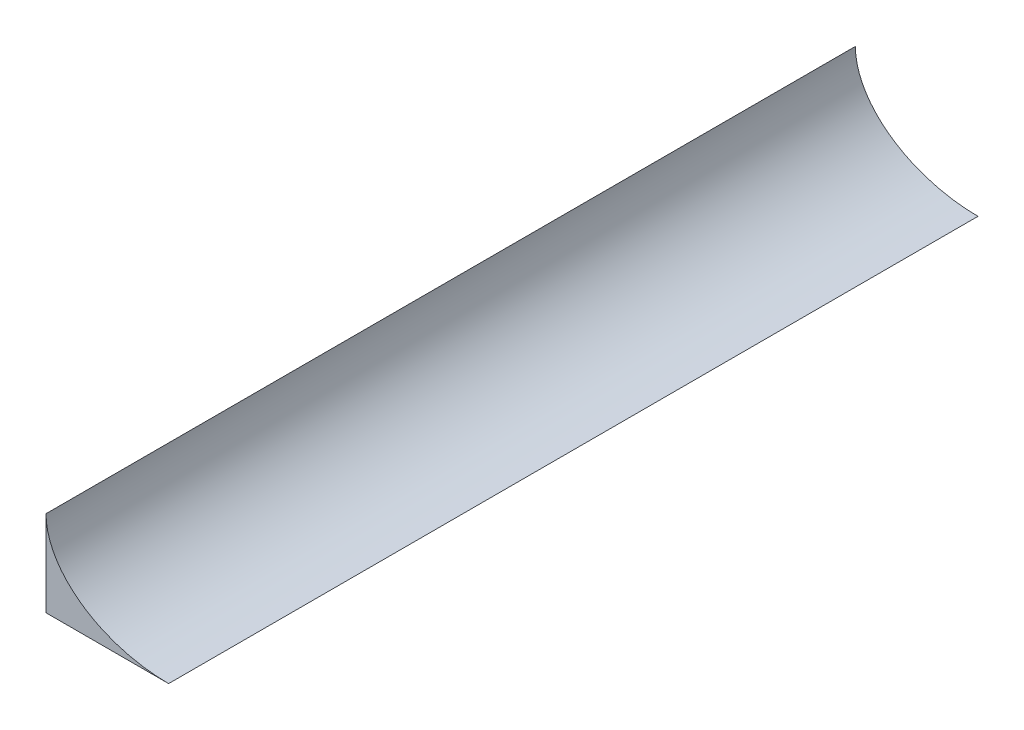
from build123d import *

# Parameters (mm, degrees)
SKETCH1_W           = 10
SKETCH1_H           = 66
BOSS_EXTRUDE1_DEPTH = 7
CUT_EXTRUDE1_DEPTH  = 68.119296778


with BuildPart() as part:
    # Sketch1 → Boss-Extrude1 (new body)
    with BuildSketch(Plane(origin=(0, 0, 0), x_dir=(1, 0, 0), z_dir=(0, 1, 0))):
        with Locations((5, 33)):
            Rectangle(SKETCH1_W, SKETCH1_H)
    extrude(amount=BOSS_EXTRUDE1_DEPTH)

    # Sketch2 → Cut-Extrude1 (cut, through all)
    with BuildSketch(Plane.XY):
        with BuildLine():
            Line((0, 7), (10, 7))
            Line((10, 7), (10, 0))
            add(Edge.make_bspline(
                [(0, 7), (0, 0), (10, 0)],
                knots=[0, 0, 0, 1.570796327, 1.570796327, 1.570796327], degree=2, weights=[1, 0.707106781, 1]))
        make_face()
    extrude(amount=-CUT_EXTRUDE1_DEPTH, mode=Mode.SUBTRACT)


solid = part.part
